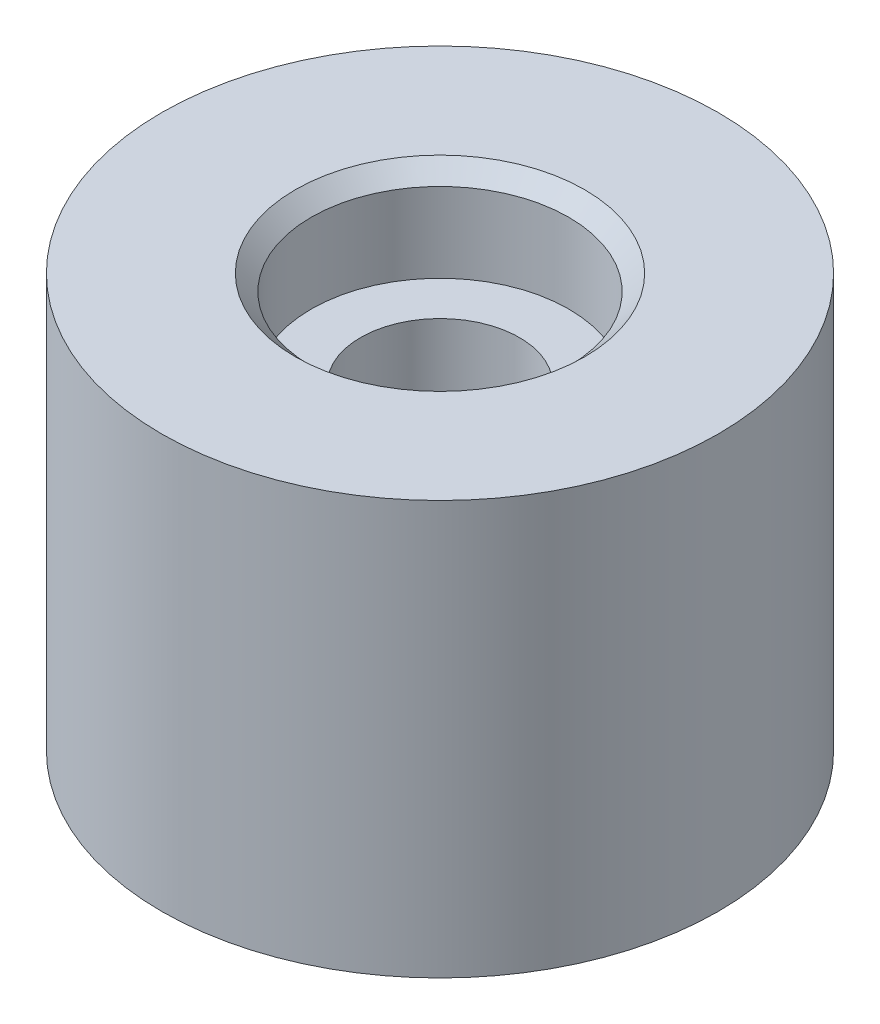
from build123d import *

# Parameters (mm, degrees)
SKETCH1_R           = 8.75
BOSS_EXTRUDE1_DEPTH = 13
CUT_EXTRUDE1_REACH  = 19.948
SKETCH2_R           = 2.5
SKETCH3_R           = 4.05
CUT_EXTRUDE2_DEPTH  = 3
CHAMFER1_SIZE       = 0.5


with BuildPart() as part:
    # Sketch1 → Boss-Extrude1 (new body)
    with BuildSketch(Plane(origin=(0, 0, 0), x_dir=(1, 0, 0), z_dir=(0, 1, 0))):
        with Locations(Location((0, 0, 0), (0, 0, 90))):
            Circle(SKETCH1_R)
    extrude(amount=BOSS_EXTRUDE1_DEPTH)

    # Sketch2 → Cut-Extrude1 (cut, up to next)
    with BuildSketch(Plane(origin=(0, 13, 0), x_dir=(1, 0, 0), z_dir=(0, 1, 0)), mode=Mode.PRIVATE) as cut_extrude1_sk1:
        with Locations(Location((0, 0, 0), (0, 0, 270))):
            Circle(SKETCH2_R)
    cut_extrude1_tool1 = extrude(cut_extrude1_sk1.sketch, amount=-CUT_EXTRUDE1_REACH, mode=Mode.PRIVATE) & part.part
    add(cut_extrude1_tool1.solids().sort_by_distance((0, 13, 0))[0], mode=Mode.SUBTRACT)

    # Sketch3 → Cut-Extrude2 (cut)
    with BuildSketch(Plane(origin=(0, 13, 0), x_dir=(1, 0, 0), z_dir=(0, 1, 0))):
        with Locations(Location((0, 0, 0), (0, 0, 270))):
            Circle(SKETCH3_R)
    cut_extrude2 = extrude(amount=-CUT_EXTRUDE2_DEPTH, mode=Mode.SUBTRACT)

    # Mirror3: Cut-Extrude2 across plane
    add(cut_extrude2.mirror(Plane.ZX.offset(6.5)), mode=Mode.SUBTRACT)

    # Chamfer1
    chamfer1_edges = [part.edges().sort_by_distance(p)[0] for p in [
        (0, 13, -4.05),
        (0, 0, -4.05),
    ]]
    chamfer(chamfer1_edges, length=CHAMFER1_SIZE)


solid = part.part
